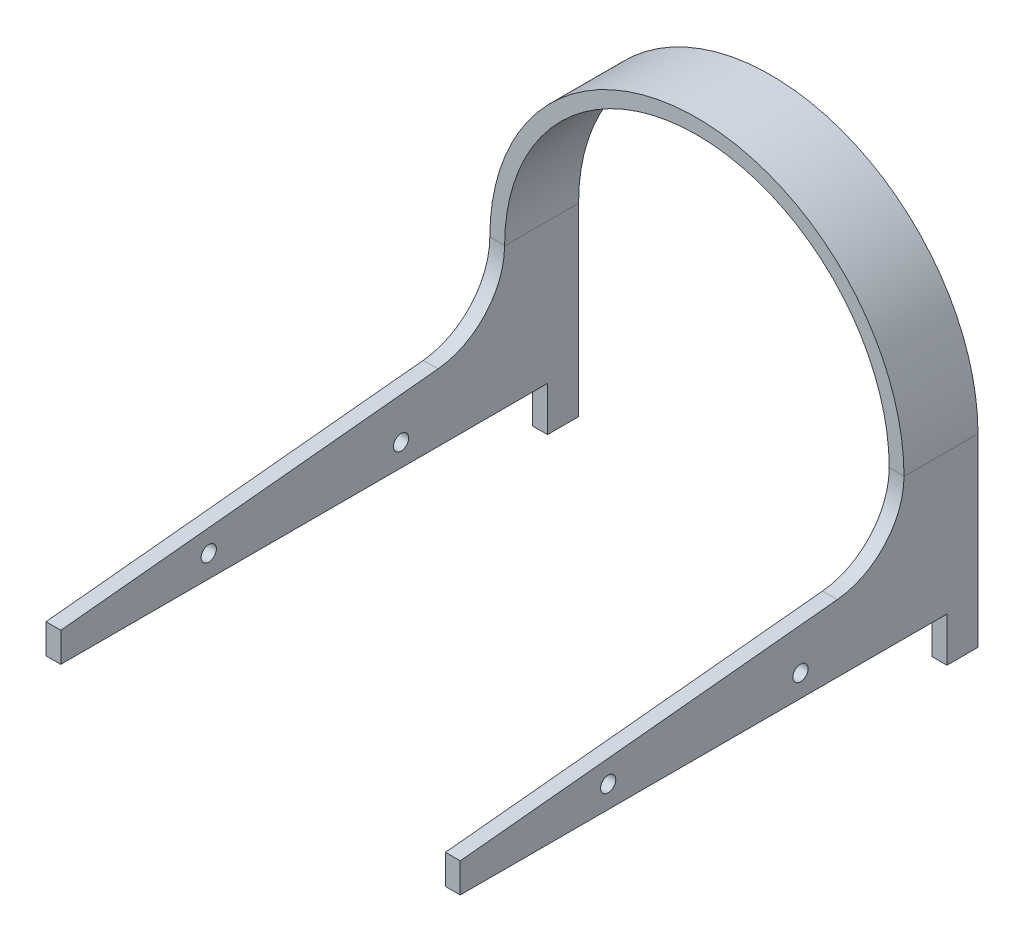
from build123d import *

# Parameters (mm, degrees)
EXTRUDE_1_DEPTH     = 350
SKETCH_2_W          = 329
SKETCH_2_H          = 30
CUT_EXTRUDE_1_DEPTH = 470.574275275
SKETCH_3_R          = 5.15
CUT_EXTRUDE_2_DEPTH = 470.574275364


with BuildPart() as part:
    # 草图1 → 凸台-拉伸1 (new body)
    with BuildSketch(Plane.XY):
        with BuildLine():
            Line((-140, 0), (-140, -125))
            Line((-140, -125), (-130, -125))
            Line((-130, -125), (-130, 0))
            ThreePointArc((-130, 0), (0, 130), (130, 0))
            Line((130, 0), (130, -125))
            Line((130, -125), (140, -125))
            Line((140, -125), (140, 0))
            ThreePointArc((140, 0), (0, 140), (-140, 0))
        make_face()
    extrude(amount=EXTRUDE_1_DEPTH)

    # 草图2 → 切除-拉伸1 (cut, through all)
    with BuildSketch(Plane.ZY.offset(140)):
        with Locations((185.5, -110)):
            Rectangle(SKETCH_2_W, SKETCH_2_H)
        with BuildLine():
            Line((50, 140), (50, 0.249378106))
            ThreePointArc((50, 0.249378106), (62.927373322, -33.300887932), (95.024814049, -49.502481405))
            Line((95.024814049, -49.502481405), (350, -75))
            Line((350, -75), (350, 140))
            Line((350, 140), (50, 140))
        make_face()
    extrude(amount=-CUT_EXTRUDE_1_DEPTH, mode=Mode.SUBTRACT)

    # 草图3 → 切除-拉伸2 (cut, through all)
    with BuildSketch(Plane.ZY.offset(140)):
        with Locations(Location((120, -80, 0), (0, 0, 270))):
            Circle(SKETCH_3_R)
        with Locations(Location((250, -80, 0), (0, 0, 270))):
            Circle(SKETCH_3_R)
    extrude(amount=-CUT_EXTRUDE_2_DEPTH, mode=Mode.SUBTRACT)


solid = part.part
